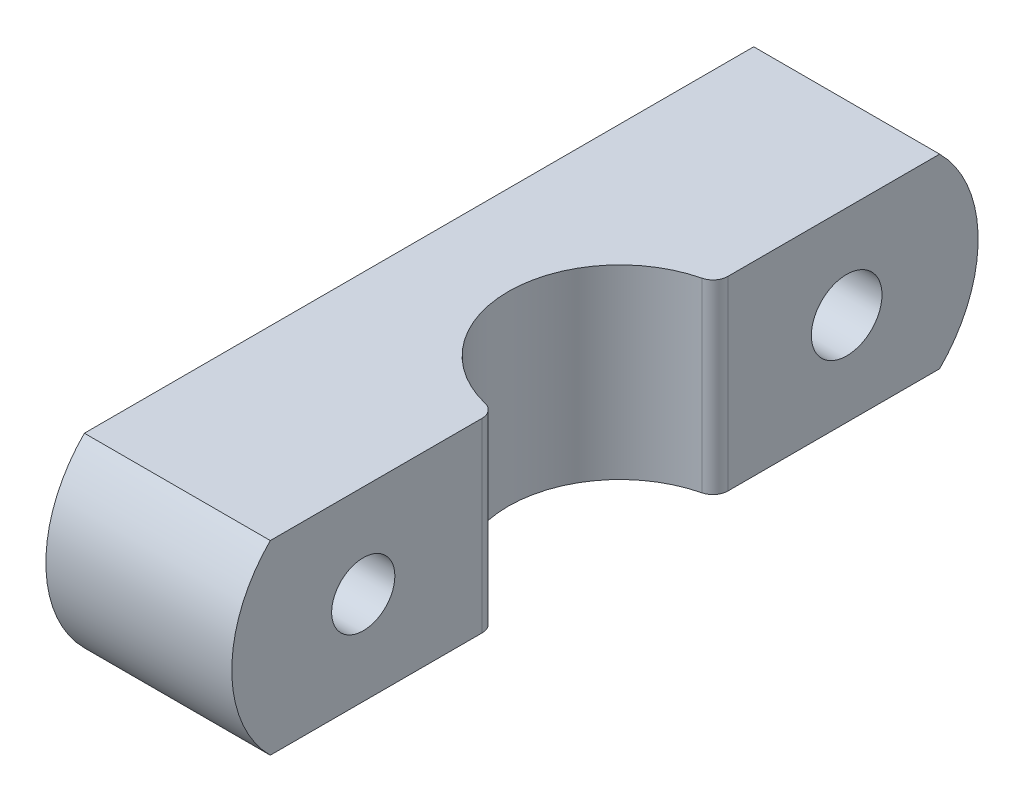
from build123d import *

# Parameters (mm, degrees)
EXTRUDE_1_DEPTH     = 10
CUT_EXTRUDE_1_DEPTH = 28.77666362
FILLET_1_R          = 0.8
SKETCH_3_R          = 1.7
SKETCH_3_R_2        = 1.9
CUT_EXTRUDE_2_DEPTH = 10


with BuildPart() as part:
    # 草图1 → 凸台-拉伸1 (new body)
    with BuildSketch(Plane(origin=(0, 0, 0), x_dir=(0, 0, -1), z_dir=(1, 0, 0))):
        with BuildLine():
            Line((-10.635898576, 16.411798263), (2.964101424, 16.411798263))
            Line((2.964101424, 16.411798263), (14.164101424, 16.411798263))
            ThreePointArc((14.164101424, 16.411798263), (16.235169236, 11.411798263), (14.164101424, 6.411798263))
            Line((14.164101424, 6.411798263), (2.964101424, 6.411798263))
            Line((2.964101424, 6.411798263), (-10.635898576, 6.411798263))
            Line((-10.635898576, 6.411798263), (-21.835898576, 6.411798263))
            ThreePointArc((-21.835898576, 6.411798263), (-23.906966388, 11.411798263), (-21.835898576, 16.411798263))
            Line((-21.835898576, 16.411798263), (-10.635898576, 16.411798263))
        make_face()
    extrude(amount=EXTRUDE_1_DEPTH)

    # 草图2 → 切除-拉伸1 (cut, through all)
    with BuildSketch(Plane.XZ.offset(-6.411798263)):
        with BuildLine():
            Line((10, 9.782326075), (10, -2.110528923))
            ThreePointArc((10, -2.110528923), (4.8, 3.835898576), (10, 9.782326075))
        make_face()
    extrude(amount=-CUT_EXTRUDE_1_DEPTH, mode=Mode.SUBTRACT)

    # 圆角1
    fillet_1_edges = [part.edges().sort_by_distance(p)[0] for p in [
        (10, 11.411798263, -2.110528923),
        (10, 11.411798263, 9.782326075),
    ]]
    fillet(fillet_1_edges, radius=FILLET_1_R)

    # 草图3 → 切除-拉伸2 (cut)
    with BuildSketch(Plane(origin=(10, 0, 0), x_dir=(0, 0, -1), z_dir=(1, 0, 0))):
        with Locations((-16.835898576, 11.411798263)):
            Circle(SKETCH_3_R)
        with Locations((9.164101424, 11.411798263)):
            Circle(SKETCH_3_R_2)
    extrude(amount=-CUT_EXTRUDE_2_DEPTH, mode=Mode.SUBTRACT)


solid = part.part
